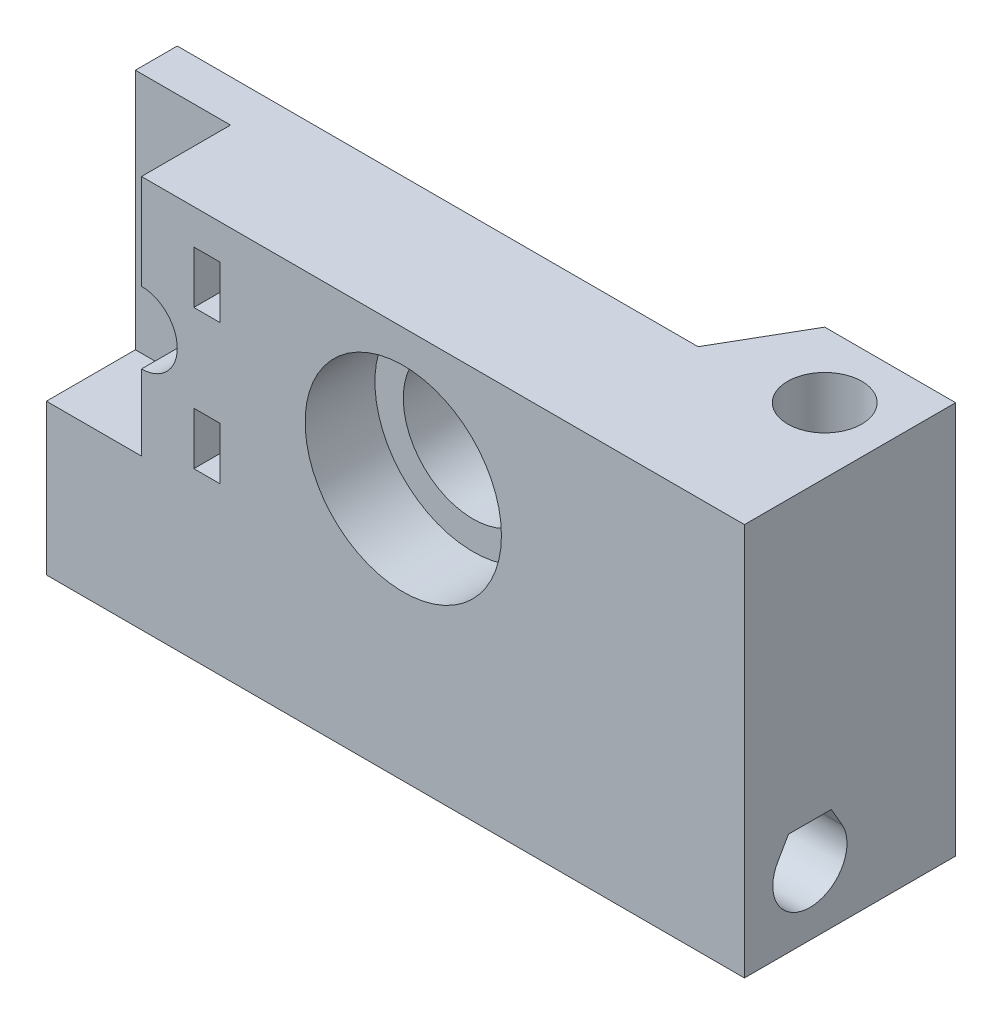
from build123d import *

# Parameters (mm, degrees)
SCHIZZO2_W                   = 80
SCHIZZO2_H                   = 30
ESTRUSIONE_ESTRUSIONE1_DEPTH = 12.1
SCHIZZO3_R                   = 4.25
TAGLIO_ESTRUSIONE1_DEPTH     = 52.443269725
SCHIZZO4_R                   = 11.25
TAGLIO_ESTRUSIONE2_DEPTH     = 8
SCHIZZO5_R                   = 8
TAGLIO_ESTRUSIONE3_DEPTH     = 46.688510591
ESTRUSIONE_ESTRUSIONE2_START = -15
SCHIZZO6_W                   = 80
SCHIZZO6_H                   = 24.2
SCHIZZO6_R                   = 4.25
ESTRUSIONE_ESTRUSIONE2_DEPTH = 15
TAGLIO_ESTRUSIONE4_DEPTH     = 87.292583691
TAGLIO_ESTRUSIONE5_DEPTH     = 62.411806682
SCHIZZO8_R                   = 4.1
TAGLIO_ESTRUSIONE6_DEPTH     = 12
SCHIZZO10_W                  = 10.2
SCHIZZO10_H                  = 27.75
TAGLIO_ESTRUSIONE7_DEPTH     = 10.9
TAGLIO_ESTRUSIONE8_DEPTH     = 12
SCHIZZO12_W                  = 3
SCHIZZO12_H                  = 6
TAGLIO_ESTRUSIONE9_DEPTH     = 8.2


with BuildPart() as part:
    # Schizzo2 → Estrusione-Estrusione1 (new, symmetric)
    with BuildSketch(Plane.XY):
        Rectangle(SCHIZZO2_W, SCHIZZO2_H)
    extrude(amount=ESTRUSIONE_ESTRUSIONE1_DEPTH, both=True)

    # Schizzo3 → Taglio-Estrusione1 (cut, through all)
    with BuildSketch(Plane.XZ.offset(15)):
        with Locations(Location((32.5, -4.6, 0), (0, 0, 270))):
            Circle(SCHIZZO3_R)
    extrude(amount=-TAGLIO_ESTRUSIONE1_DEPTH, mode=Mode.SUBTRACT)

    # Schizzo4 → Taglio-Estrusione2 (cut)
    with BuildSketch(Plane.XY.offset(12.1)):
        with Locations((0.9, 0)):
            Circle(SCHIZZO4_R)
    extrude(amount=-TAGLIO_ESTRUSIONE2_DEPTH, mode=Mode.SUBTRACT)

    # Schizzo5 → Taglio-Estrusione3 (cut, through all)
    with BuildSketch(Plane.XY.offset(4.1)):
        with Locations((0.9, 0)):
            Circle(SCHIZZO5_R)
    extrude(amount=-TAGLIO_ESTRUSIONE3_DEPTH, mode=Mode.SUBTRACT)

    # Schizzo6 → Estrusione-Estrusione2 (add)
    with BuildSketch(Plane(origin=(0, -15, 0), x_dir=(1, 0, 0), z_dir=(0, 1, 0)).offset(ESTRUSIONE_ESTRUSIONE2_START)):
        Rectangle(SCHIZZO6_W, SCHIZZO6_H)
        with Locations(Location((32.5, 4.6, 0), (0, 0, 90))):
            Circle(SCHIZZO6_R, mode=Mode.SUBTRACT)
    extrude(amount=ESTRUSIONE_ESTRUSIONE2_DEPTH)

    # Schizzo7 → Taglio-Estrusione4 (cut, through all)
    with BuildSketch(Plane(origin=(40, 0, 0), x_dir=(0, 0, -1), z_dir=(1, 0, 0))):
        with BuildLine():
            Line((-2.146261356, -18.25), (-7.053738644, -18.25))
            Line((-7.053738644, -18.25), (-8.280607966, -20.375))
            ThreePointArc((-8.280607966, -20.375), (-4.6, -26.75), (-0.919392034, -20.375))
            Line((-0.919392034, -20.375), (-2.146261356, -18.25))
        make_face()
    extrude(amount=-TAGLIO_ESTRUSIONE4_DEPTH, mode=Mode.SUBTRACT)

    # Schizzo9 → Taglio-Estrusione5 (cut, through all)
    with BuildSketch(Plane.XZ.offset(-15)):
        Polygon((25, -12.1), (19.688377523, -2.9), (-40, -2.9), (-40, -12.1), align=None)
    extrude(amount=TAGLIO_ESTRUSIONE5_DEPTH, mode=Mode.SUBTRACT)

    # Schizzo8 → Taglio-Estrusione6 (cut)
    with BuildSketch(Plane.XY.offset(12.1)):
        with Locations((-29.1, 0)):
            Circle(SCHIZZO8_R)
    extrude(amount=-TAGLIO_ESTRUSIONE6_DEPTH, mode=Mode.SUBTRACT)

    # Schizzo10 → Taglio-Estrusione7 (cut)
    with BuildSketch(Plane.ZY.offset(40)):
        with Locations((7, 1.125)):
            Rectangle(SCHIZZO10_W, SCHIZZO10_H)
    extrude(amount=-TAGLIO_ESTRUSIONE7_DEPTH, mode=Mode.SUBTRACT)

    # Schizzo11 → Taglio-Estrusione8 (cut)
    with BuildSketch(Plane.ZY.offset(29.1)):
        with BuildLine():
            Line((8.110362971, 6.25), (6.089637029, 6.25))
            Line((6.089637029, 6.25), (5.584455543, 7.125))
            ThreePointArc((5.584455543, 7.125), (7.1, 9.75), (8.615544457, 7.125))
            Line((8.615544457, 7.125), (8.110362971, 6.25))
        make_face()
        with BuildLine():
            Line((8.110362971, -9.75), (6.089637029, -9.75))
            Line((6.089637029, -9.75), (5.584455543, -8.875))
            ThreePointArc((5.584455543, -8.875), (7.1, -6.25), (8.615544457, -8.875))
            Line((8.615544457, -8.875), (8.110362971, -9.75))
        make_face()
    extrude(amount=-TAGLIO_ESTRUSIONE8_DEPTH, mode=Mode.SUBTRACT)

    # Schizzo12 → Taglio-Estrusione9 (cut)
    with BuildSketch(Plane.XY.offset(12.1)):
        with Locations((-21.6, -8)):
            Rectangle(SCHIZZO12_W, SCHIZZO12_H)
        with Locations((-21.6, 8)):
            Rectangle(SCHIZZO12_W, SCHIZZO12_H)
    extrude(amount=-TAGLIO_ESTRUSIONE9_DEPTH, mode=Mode.SUBTRACT)


solid = part.part
